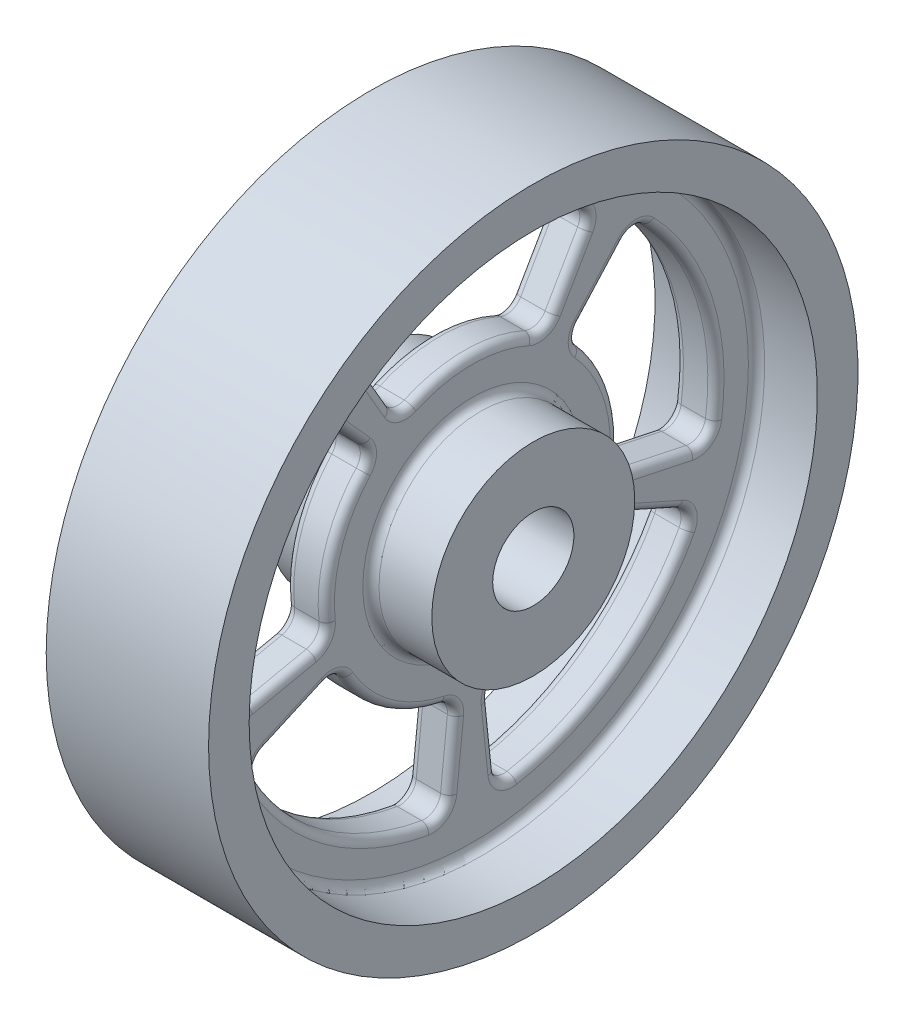
from build123d import *

# Parameters (mm, degrees)
CUT_EXTRUDE1_DEPTH       = 10
FILLET2_R                = 2
FILLET3_R                = 2
FILLET4_R                = 2
CIRPATTERN1_COUNT        = 5
FILLET2_OF_CIRPATTERN1_R = 2
FILLET3_OF_CIRPATTERN1_R = 2
FILLET4_OF_CIRPATTERN1_R = 2
FILLET5_R                = 1


with BuildPart() as part:
    # Sketch1 → Revolve1 (revolve)
    with BuildSketch(Plane.XY, mode=Mode.PRIVATE) as revolve1_sk:
        Polygon((2.5, 35), (10, 35), (10, 40), (-10, 40), (-10, 35), (-2.5, 35), (-2.5, 12.5), (-10, 12.5), (-10, 5), (10, 5), (10, 12.5), (2.5, 12.5), align=None)
    revolve(revolve1_sk.sketch.rotate(Axis((0, 0, 0), (1, 0, 0)), 90), axis=Axis((0, 0, 0), (1, 0, 0)))

    # Sketch2 → Cut-Extrude1 (cut)
    with BuildSketch(Plane(origin=(2.5, 0, 0), x_dir=(0, 0, -1), z_dir=(1, 0, 0))):
        with BuildLine():
            Line((-15, 25.980762114), (-9, 15.588457268))
            ThreePointArc((-9, 15.588457268), (0, 18), (9, 15.588457268))
            Line((9, 15.588457268), (15, 25.980762114))
            ThreePointArc((15, 25.980762114), (0, 30), (-15, 25.980762114))
        make_face()
    cut_extrude1 = extrude(amount=-CUT_EXTRUDE1_DEPTH, mode=Mode.SUBTRACT)

    # Fillet2
    fillet2_edges = [part.edges().sort_by_distance(p)[0] for p in [
        (0, 25.980762114, -15),
    ]]
    fillet(fillet2_edges, radius=FILLET2_R)

    # Fillet3
    fillet3_edges = [part.edges().sort_by_distance(p)[0] for p in [
        (0, 15.588457268, -9),
        (0, 15.588457268, 9),
    ]]
    fillet(fillet3_edges, radius=FILLET3_R)

    # Fillet4
    fillet4_edges = [part.edges().sort_by_distance(p)[0] for p in [
        (0, 25.980762114, 15),
    ]]
    fillet(fillet4_edges, radius=FILLET4_R)

    # CirPattern1: Cut-Extrude1 ×5 about axis
    cirpattern1_axis = Axis((0, 0, 0), (1, 0, 0))
    for i in range(1, CIRPATTERN1_COUNT):
        add(cut_extrude1.rotate(cirpattern1_axis, i * 360 / CIRPATTERN1_COUNT), mode=Mode.SUBTRACT)

    # Fillet2 of CirPattern1
    fillet2_of_cirpattern1_edges = [part.edges().sort_by_distance(p)[0] for p in [
        (0, 22.294344764, 20.073918191),
        (0, -12.202099292, 27.406363729),
        (0, -29.835656861, -3.135853898),
        (0, -6.237350725, -29.344428022),
    ]]
    fillet(fillet2_of_cirpattern1_edges, radius=FILLET2_OF_CIRPATTERN1_R)

    # Fillet3 of CirPattern1
    fillet3_of_cirpattern1_edges = [part.edges().sort_by_distance(p)[0] for p in [
        (0, 13.376606859, 12.044350914),
        (0, -3.742410435, 17.606656813),
        (0, -7.321259575, 16.443818238),
        (0, -17.901394117, 1.881512339),
        (0, -17.901394117, -1.881512339),
        (0, -7.321259575, -16.443818238),
        (0, -3.742410435, -17.606656813),
        (0, 13.376606859, -12.044350914),
    ]]
    fillet(fillet3_of_cirpattern1_edges, radius=FILLET3_OF_CIRPATTERN1_R)

    # Fillet4 of CirPattern1
    fillet4_of_cirpattern1_edges = [part.edges().sort_by_distance(p)[0] for p in [
        (0, -6.237350725, 29.344428022),
        (0, -29.835656861, 3.135853898),
        (0, -12.202099292, -27.406363729),
        (0, 22.294344764, -20.073918191),
    ]]
    fillet(fillet4_of_cirpattern1_edges, radius=FILLET4_OF_CIRPATTERN1_R)

    # Fillet5
    fillet5_edges = [part.edges().sort_by_distance(p)[0] for p in [
        (2.5, 0, -12.5),
        (2.5, 0, -35),
        (2.5, 9.270509831, -28.531695489),
        (-2.5, 9.270509831, -28.531695489),
        (2.5, -5.487704354, -28.882524769),
        (-2.5, -5.487704354, -28.882524769),
        (2.5, -24.270509831, -17.633557569),
        (-2.5, -24.270509831, -17.633557569),
        (2.5, -29.164707294, -3.706074009),
        (-2.5, -29.164707294, -3.706074009),
        (2.5, -24.270509831, 17.633557569),
        (-2.5, -24.270509831, 17.633557569),
        (2.5, -12.537076026, 26.592045067),
        (-2.5, -12.537076026, 26.592045067),
        (2.5, 9.270509831, 28.531695489),
        (-2.5, 9.270509831, 28.531695489),
        (2.5, 21.416368191, 20.14086169),
        (-2.5, 21.416368191, 20.14086169),
        (2.5, 5.562305899, -17.119017293),
        (-2.5, 5.562305899, -17.119017293),
        (2.5, -4.972023962, -23.391533639),
        (-2.5, -4.972023962, -23.391533639),
        (2.5, 13.445581763, -12.801825774),
        (-2.5, 13.445581763, -12.801825774),
        (2.5, -3.352979753, -18.260009279),
        (-2.5, -3.352979753, -18.260009279),
        (2.5, -14.562305899, -10.580134541),
        (-2.5, -14.562305899, -10.580134541),
        (2.5, -23.783110394, -2.49970563),
        (-2.5, -23.783110394, -2.49970563),
        (2.5, -8.020346559, -16.743489875),
        (-2.5, -8.020346559, -16.743489875),
        (2.5, -18.402428538, -2.453779941),
        (-2.5, -18.402428538, -2.453779941),
        (2.5, -14.562305899, 10.580134541),
        (-2.5, -14.562305899, 10.580134541),
        (2.5, -9.726746619, 21.846630597),
        (-2.5, -9.726746619, 21.846630597),
        (2.5, -18.402428538, 2.453779941),
        (-2.5, -18.402428538, 2.453779941),
        (2.5, -8.020346559, 16.743489875),
        (-2.5, -8.020346559, 16.743489875),
        (2.5, 5.562305899, 17.119017293),
        (-2.5, 5.562305899, 17.119017293),
        (2.5, 17.771650383, 16.001665879),
        (-2.5, 17.771650383, 16.001665879),
        (2.5, -3.352979753, 18.260009279),
        (-2.5, -3.352979753, 18.260009279),
        (2.5, 13.445581763, 12.801825774),
        (-2.5, 13.445581763, 12.801825774),
        (2.5, 17.771650383, -16.001665879),
        (-2.5, 17.771650383, -16.001665879),
        (2.5, 21.416368191, -20.14086169),
        (-2.5, 21.416368191, -20.14086169),
        (2.5, -9.726746619, -21.846630597),
        (-2.5, -9.726746619, -21.846630597),
        (2.5, -12.537076026, -26.592045067),
        (-2.5, -12.537076026, -26.592045067),
        (2.5, -23.783110394, 2.49970563),
        (-2.5, -23.783110394, 2.49970563),
        (2.5, -29.164707294, 3.706074009),
        (-2.5, -29.164707294, 3.706074009),
        (2.5, -4.972023962, 23.391533639),
        (-2.5, -4.972023962, 23.391533639),
        (2.5, -5.487704354, 28.882524769),
        (-2.5, -5.487704354, 28.882524769),
        (2.5, 30, 0),
        (-2.5, 30, 0),
        (2.5, 25.773119483, -14.14430798),
        (-2.5, 25.773119483, -14.14430798),
        (2.5, 18, 0),
        (-2.5, 18, 0),
        (2.5, 20.710230592, -11.957057207),
        (-2.5, 20.710230592, -11.957057207),
        (2.5, 16.330173087, 8.831526428),
        (-2.5, 16.330173087, 8.831526428),
        (2.5, 16.330173087, -8.831526428),
        (-2.5, 16.330173087, -8.831526428),
        (2.5, 20.710230592, 11.957057207),
        (-2.5, 20.710230592, 11.957057207),
        (2.5, 25.773119483, 14.14430798),
        (-2.5, 25.773119483, 14.14430798),
        (-2.5, 0, -35),
        (-2.5, 0, -12.5),
    ]]
    fillet(fillet5_edges, radius=FILLET5_R)


solid = part.part
